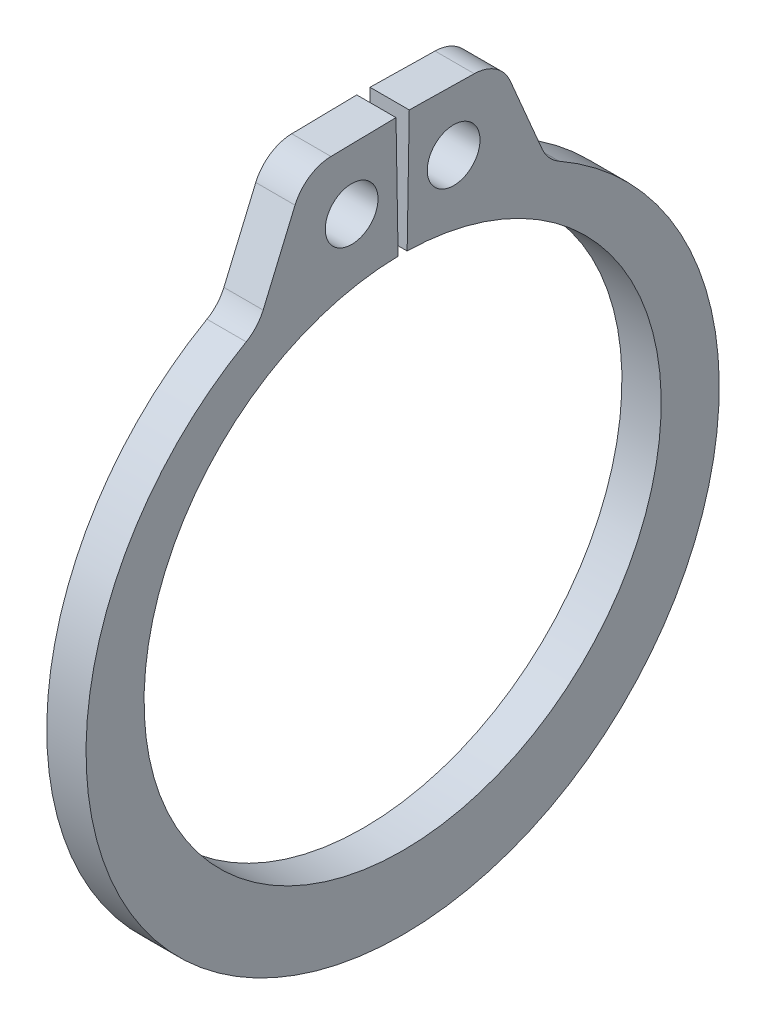
from build123d import *

# Parameters (mm, degrees)
SKETCH1_R           = 0.5969
BOSS_EXTRUDE1_DEPTH = 0.889


with BuildPart() as part:
    # Sketch1 → Boss-Extrude1 (new body)
    with BuildSketch(Plane(origin=(-0.4445, 0, 0), x_dir=(0, -1, 0), z_dir=(-1, 0, 0))):
        with BuildLine():
            Line((-8.570893386, 1.622240596), (-8.596590498, 0.150054045))
            Line((-8.596590498, 0.150054045), (-5.853808301, 0.102178604))
            ThreePointArc((-5.853808301, 0.102178604), (5.8547, 0), (-5.853808301, -0.102178604))
            Line((-5.853808301, -0.102178604), (-8.596590498, -0.150054045))
            Line((-8.596590498, -0.150054045), (-8.570893386, -1.622240596))
            ThreePointArc((-8.570893386, -1.622240596), (-8.417102656, -2.11038869), (-8.022406216, -2.436202854))
            Line((-8.022406216, -2.436202854), (-6.326164566, -3.158032453))
            ThreePointArc((-6.326164566, -3.158032453), (-6.079165978, -3.314698127), (-5.89530863, -3.542181999))
            ThreePointArc((-5.89530863, -3.542181999), (7.5057, 0), (-5.89530863, 3.542181999))
            ThreePointArc((-5.89530863, 3.542181999), (-6.079165978, 3.314698127), (-6.326164566, 3.158032453))
            Line((-6.326164566, 3.158032453), (-8.022406216, 2.436202854))
            ThreePointArc((-8.022406216, 2.436202854), (-8.417102656, 2.11038869), (-8.570893386, 1.622240596))
        make_face()
        with Locations(Location((-7.207246109, -1.154659649, 0), (0, 0, 270))):
            Circle(SKETCH1_R, mode=Mode.SUBTRACT)
        with Locations(Location((-7.207246109, 1.154659649, 0), (0, 0, 270))):
            Circle(SKETCH1_R, mode=Mode.SUBTRACT)
    extrude(amount=-BOSS_EXTRUDE1_DEPTH)


solid = part.part
